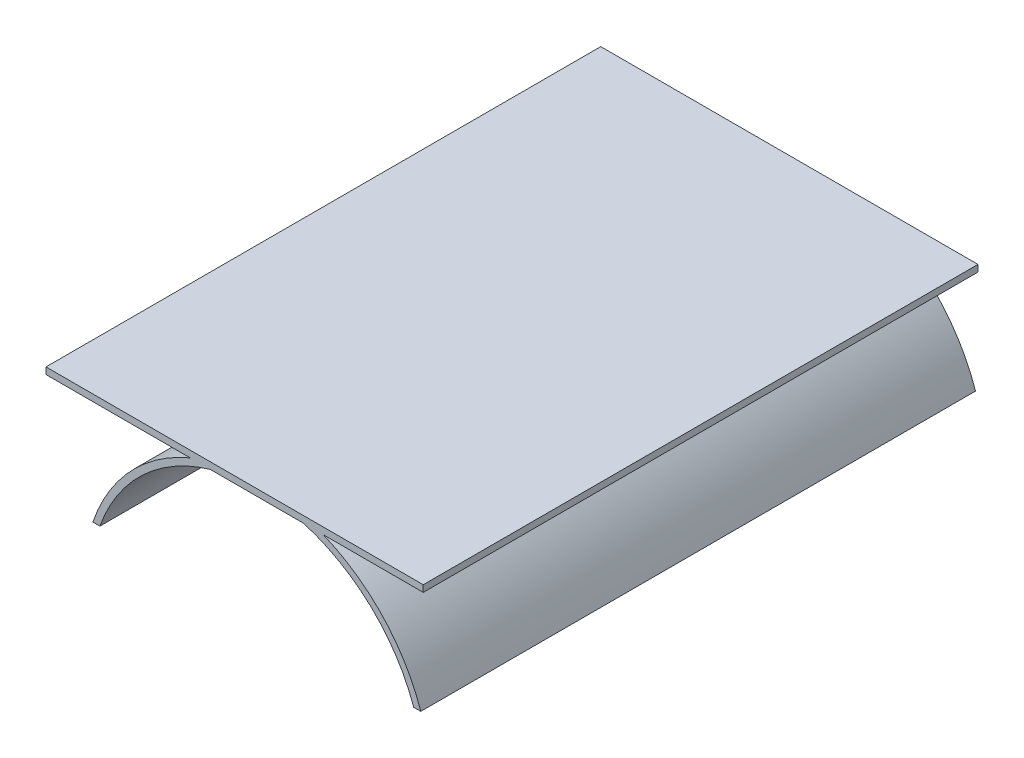
from build123d import *

# Parameters (mm, degrees)
ESQUISSE1_W        = 170
ESQUISSE1_H        = 3
BOSS_EXTRU_1_DEPTH = 250
BOSS_EXTRU_2_DEPTH = 250


with BuildPart() as part:
    # Esquisse1 → Boss.-Extru.1 (new body)
    with BuildSketch(Plane.XY):
        with Locations((85, 1.5)):
            Rectangle(ESQUISSE1_W, ESQUISSE1_H)
    extrude(amount=BOSS_EXTRU_1_DEPTH)

    # Esquisse3 → Boss.-Extru.2 (add)
    with BuildSketch(Plane.XY.offset(250)):
        with BuildLine():
            Line((21.114954152, -47), (24.289321881, -47))
            ThreePointArc((24.289321881, -47), (43.473675463, -17.501946092), (74, 0))
            Line((74, 0), (65, 0))
            ThreePointArc((65, 0), (37.988810855, -18.767262777), (21.114954152, -47))
        make_face()
        with BuildLine():
            Line((165.710678119, -47), (168.885045848, -47))
            ThreePointArc((168.885045848, -47), (152.011189145, -18.767262777), (125, 0))
            Line((125, 0), (116, 0))
            ThreePointArc((116, 0), (146.526324537, -17.501946092), (165.710678119, -47))
        make_face()
    extrude(amount=-BOSS_EXTRU_2_DEPTH)


solid = part.part
